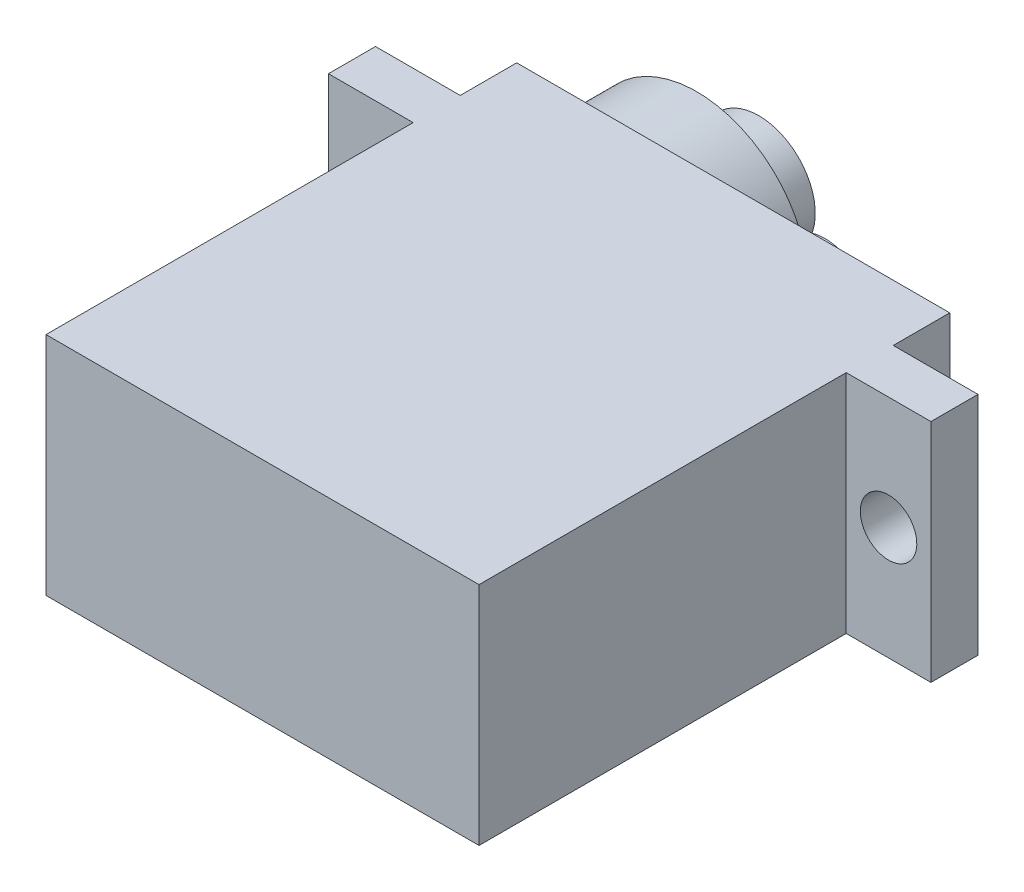
from build123d import *

# Parameters (mm, degrees)
SKETCH1_W            = 23
SKETCH1_H            = 12
BOSS_EXTRUDE1_DEPTH  = 25
SKETCH3_W            = 2.5
SKETCH3_H            = 12
BOSS_EXTRUDE2_DEPTH  = 4.5
SKETCH4_W            = 2.5
SKETCH4_H            = 12
BOSS_EXTRUDE3_DEPTH  = 4.5
SKETCH5_R            = 5.955396546
SKETCH5_R_2          = 2.472840408
SKETCH5_R_3          = 1.966091401
BOSS_EXTRUDE13_DEPTH = 3.5
SKETCH7_R            = 3
BOSS_EXTRUDE14_DEPTH = 3.5
SKETCH8_R            = 1.5
CUT_EXTRUDE1_DEPTH   = 3.5
SKETCH9_W            = 0.717948718
SKETCH9_H            = 0.583333333
CUT_EXTRUDE2_DEPTH   = 3.5
CUT_EXTRUDE3_DEPTH   = 3.5


with BuildPart() as part:
    # Sketch1 → Boss-Extrude1 (new body)
    with BuildSketch(Plane.XY):
        Rectangle(SKETCH1_W, SKETCH1_H)
    extrude(amount=BOSS_EXTRUDE1_DEPTH)

    # Sketch3 → Boss-Extrude2 (add)
    with BuildSketch(Plane(origin=(11.5, 0, 0), x_dir=(0, 0, -1), z_dir=(1, 0, 0))):
        with Locations((-4.25, 0)):
            Rectangle(SKETCH3_W, SKETCH3_H)
    extrude(amount=BOSS_EXTRUDE2_DEPTH)

    # Sketch4 → Boss-Extrude3 (add)
    with BuildSketch(Plane.ZY.offset(11.5)):
        with Locations((4.25, 0)):
            Rectangle(SKETCH4_W, SKETCH4_H)
    extrude(amount=BOSS_EXTRUDE3_DEPTH)

    # Sketch5 → Boss-Extrude13 (add)
    # profile 1 of 7: a face of its own
    with BuildSketch(Plane(origin=(0, 0, 0), x_dir=(-1, 0, 0), z_dir=(0, 0, -1))):
        with Locations((5.443001461, 0)):
            Circle(SKETCH5_R)
    # profile 2 of 7: a face of its own
    with BuildSketch(Plane(origin=(0, 0, 0), x_dir=(-1, 0, 0), z_dir=(0, 0, -1))):
        with Locations((-1.369559257, 0.13462889)):
            Circle(SKETCH5_R_2)
    # profile 3 of 7: a face of its own
    with BuildSketch(Plane(origin=(0, 0, 0), x_dir=(-1, 0, 0), z_dir=(0, 0, -1))):
        with Locations((-1.369559257, 0.13462889)):
            Circle(SKETCH5_R_2)
    # profile 4 of 7: a face of its own
    with BuildSketch(Plane(origin=(0, 0, 0), x_dir=(-1, 0, 0), z_dir=(0, 0, -1))):
        with Locations((5.443001461, 0)):
            Circle(SKETCH5_R)
        with Locations((5.443001461, 0)):
            Circle(SKETCH5_R_3, mode=Mode.SUBTRACT)
    # profile 5 of 7: a face of its own
    with BuildSketch(Plane(origin=(0, 0, 0), x_dir=(-1, 0, 0), z_dir=(0, 0, -1))):
        with Locations((5.443001461, 0)):
            Circle(SKETCH5_R)
    # profile 6 of 7: a face of its own
    with BuildSketch(Plane(origin=(0, 0, 0), x_dir=(-1, 0, 0), z_dir=(0, 0, -1))):
        with Locations((-1.369559257, 0.13462889)):
            Circle(SKETCH5_R_2)
    # profile 7 of 7: a face of its own
    with BuildSketch(Plane(origin=(0, 0, 0), x_dir=(-1, 0, 0), z_dir=(0, 0, -1))):
        with Locations((5.443001461, 0)):
            Circle(SKETCH5_R_3)
    extrude(amount=BOSS_EXTRUDE13_DEPTH)

    # Sketch7 → Boss-Extrude14 (add)
    with BuildSketch(Plane(origin=(0, 0, -3.5), x_dir=(-1, 0, 0), z_dir=(0, 0, -1))):
        with Locations((5.642948454, 0)):
            Circle(SKETCH7_R)
    extrude(amount=BOSS_EXTRUDE14_DEPTH)

    # Sketch8 → Cut-Extrude1 (cut)
    with BuildSketch(Plane(origin=(0, 0, 3), x_dir=(-1, 0, 0), z_dir=(0, 0, -1))):
        with Locations(Location((13.75, 0, 0), (0, 0, 90))):
            Circle(SKETCH8_R)
        with Locations(Location((-13.75, 0, 0), (0, 0, 90))):
            Circle(SKETCH8_R)
    extrude(amount=-CUT_EXTRUDE1_DEPTH, mode=Mode.SUBTRACT)

    # Sketch9 → Cut-Extrude2 (cut)
    # profile 1 of 11: a face of its own
    with BuildSketch(Plane(origin=(0, -6, 0), x_dir=(-1, 0, 0), z_dir=(0, -1, 0))):
        with BuildLine():
            Line((-7.029498247, -7.323823988), (-7.298027894, -7.753611648))
            add(Edge.make_bspline(
                [(-7.298027894, -7.753611648), (-7.309343943, -7.725405147), (-7.330742745, -7.67206627), (-7.366596226, -7.599110292), (-7.402048427, -7.536976801), (-7.437669123, -7.486031044), (-7.473342813, -7.445609931), (-7.510051839, -7.416967875), (-7.547391075, -7.398209945), (-7.57315305, -7.395794026), (-7.58548783, -7.394637289)],
                knots=[0, 0, 0, 0, 1.513815615, 2.862645992, 4.047036384, 5.074482221, 5.956489264, 6.720440714, 7.387349671, 8, 8, 8, 8], degree=3))
            add(Edge.make_bspline(
                [(-7.58548783, -7.394637289), (-7.597078949, -7.395347529), (-7.619923321, -7.396747306), (-7.652145088, -7.411117835), (-7.679882705, -7.434714408), (-7.703986223, -7.465346606), (-7.722832591, -7.501258769), (-7.73746031, -7.540032256), (-7.745812547, -7.581245339), (-7.746899403, -7.609612593), (-7.747446965, -7.623904116)],
                knots=[0, 0, 0, 0, 0.893609532, 1.761171542, 2.674367376, 3.692096672, 4.7611719, 5.803554826, 6.893423158, 8, 8, 8, 8], degree=3))
            add(Edge.make_bspline(
                [(-7.747446965, -7.623904116), (-7.746040801, -7.652926504), (-7.743255996, -7.710403249), (-7.724018118, -7.764627863), (-7.714494241, -7.791472225)],
                knots=[0, 0, 0, 0, 1.009882784, 2, 2, 2, 2], degree=3))
            add(Edge.make_bspline(
                [(-7.714494241, -7.791472225), (-7.70993126, -7.801576539), (-7.699600847, -7.824452317), (-7.679228853, -7.861731129), (-7.65443256, -7.907087444), (-7.623173349, -7.95968464), (-7.586968291, -8.019905491), (-7.544375288, -8.087358866), (-7.497172041, -8.16291293), (-7.463105842, -8.215468417), (-7.445263471, -8.242994661)],
                knots=[0, 0, 0, 0, 0.505642727, 1.144755719, 1.936997808, 2.864123586, 3.935666884, 5.142716957, 6.503481291, 8, 8, 8, 8], degree=3))
            add(Edge.make_bspline(
                [(-7.445263471, -8.242994661), (-7.428433752, -8.268466401), (-7.396524634, -8.316760774), (-7.351220266, -8.385429738), (-7.31258455, -8.447596047), (-7.276744718, -8.500875631), (-7.248657862, -8.548471469), (-7.223632855, -8.587378257), (-7.204722279, -8.619436993), (-7.194447371, -8.638634446), (-7.190055138, -8.646840815)],
                knots=[0, 0, 0, 0, 1.533370667, 2.907268025, 4.131626108, 5.209286774, 6.131298802, 6.906451117, 7.532538771, 8, 8, 8, 8], degree=3))
            add(Edge.make_bspline(
                [(-7.190055138, -8.646840815), (-7.172396418, -8.680546144), (-7.137886386, -8.746415698), (-7.093555709, -8.845726366), (-7.058270283, -8.94329484), (-7.030486093, -9.039544956), (-7.010140983, -9.136863357), (-6.995389221, -9.237289148), (-6.986011594, -9.341940728), (-6.985092666, -9.413380616), (-6.984626452, -9.44962527)],
                knots=[0, 0, 0, 0, 1.089275112, 2.128745462, 3.110876915, 4.057562893, 4.994575095, 5.955064899, 6.96251288, 8, 8, 8, 8], degree=3))
            add(Edge.make_bspline(
                [(-6.984626452, -9.44962527), (-6.985200407, -9.484929111), (-6.986323112, -9.553986437), (-6.994070481, -9.655363931), (-7.007053572, -9.751906874), (-7.026326206, -9.843603726), (-7.049890785, -9.930895441), (-7.079250427, -10.013384977), (-7.113820498, -10.091269489), (-7.153288607, -10.163620799), (-7.197254773, -10.229263325), (-7.244045537, -10.287406565), (-7.294789099, -10.336398045), (-7.349269969, -10.375896445), (-7.406665014, -10.407331907), (-7.467504995, -10.429980486), (-7.531821505, -10.443719884), (-7.575838856, -10.445180426), (-7.598108023, -10.44591934)],
                knots=[0, 0, 0, 0, 1.308901514, 2.560323035, 3.767398777, 4.917911796, 6.032053414, 7.117382618, 8.160844707, 9.188500245, 10.169045156, 11.086613897, 11.950745906, 12.775760447, 13.574509779, 14.369631732, 15.175167501, 16, 16, 16, 16], degree=3))
            add(Edge.make_bspline(
                [(-7.598108023, -10.44591934), (-7.615672816, -10.445404716), (-7.650308144, -10.444389947), (-7.70132971, -10.435565342), (-7.750573765, -10.421722693), (-7.798106651, -10.401495443), (-7.844280041, -10.376687509), (-7.888121693, -10.345117885), (-7.930256479, -10.308423051), (-7.97127568, -10.26630974), (-8.009624417, -10.217128995), (-8.047762594, -10.162752006), (-8.083069282, -10.101044351), (-8.118630879, -10.033881483), (-8.150934908, -9.959491072), (-8.182599858, -9.87900756), (-8.213675398, -9.792456372), (-8.231747156, -9.731804288), (-8.241036709, -9.700626872)],
                knots=[0, 0, 0, 0, 0.796343935, 1.570279377, 2.342178525, 3.112109005, 3.909229001, 4.715324593, 5.557166864, 6.44198091, 7.377558535, 8.383433228, 9.452692693, 10.600350218, 11.829778021, 13.129265353, 14.524336153, 16, 16, 16, 16], degree=3))
            Line((-8.241036709, -9.700626872), (-7.932543119, -9.368996263))
            add(Edge.make_bspline(
                [(-7.932543119, -9.368996263), (-7.920967347, -9.404169009), (-7.899161549, -9.470425484), (-7.863209485, -9.562231234), (-7.824656248, -9.639491931), (-7.785829595, -9.703495837), (-7.745247411, -9.753791903), (-7.702909219, -9.789765423), (-7.658524534, -9.813526945), (-7.627344513, -9.816341078), (-7.612130459, -9.817714212)],
                knots=[0, 0, 0, 0, 1.528548029, 2.879394288, 4.065931244, 5.088610491, 5.965669334, 6.719195773, 7.375041301, 8, 8, 8, 8], degree=3))
            add(Edge.make_bspline(
                [(-7.612130459, -9.817714212), (-7.596711982, -9.816567756), (-7.566047872, -9.814287695), (-7.523157313, -9.793375674), (-7.484154899, -9.761388037), (-7.451208415, -9.717325694), (-7.42351825, -9.665965963), (-7.403045396, -9.609540189), (-7.3909015, -9.548998342), (-7.38929582, -9.507407017), (-7.388472606, -9.486083603)],
                knots=[0, 0, 0, 0, 0.837168625, 1.664952531, 2.553613952, 3.571843386, 4.645016646, 5.730630069, 6.836519038, 8, 8, 8, 8], degree=3))
            add(Edge.make_bspline(
                [(-7.388472606, -9.486083603), (-7.388967485, -9.466184138), (-7.389962443, -9.426176072), (-7.399541042, -9.366265812), (-7.415018915, -9.306399624), (-7.433365102, -9.256392682), (-7.452100276, -9.214447434), (-7.469792333, -9.178751228), (-7.490536749, -9.138705908), (-7.516347866, -9.095577405), (-7.54413424, -9.047470668), (-7.57632928, -8.995751899), (-7.613135655, -8.940656896), (-7.638332314, -8.902300301), (-7.651393279, -8.882417738)],
                knots=[0, 0, 0, 0, 1.070477827, 2.152205962, 3.256735731, 4.394924439, 5.014414402, 5.728928141, 6.539236128, 7.441139399, 8.433599816, 9.529715778, 10.719501013, 12, 12, 12, 12], degree=3))
            add(Edge.make_bspline(
                [(-7.651393279, -8.882417738), (-7.676819062, -8.844678156), (-7.725791945, -8.771987529), (-7.793704535, -8.664800969), (-7.855877844, -8.565077118), (-7.909485343, -8.470828053), (-7.957451469, -8.384147933), (-7.998422152, -8.30407152), (-8.032150964, -8.230632702), (-8.067728126, -8.14223749), (-8.100790695, -8.035415776), (-8.129705466, -7.908163875), (-8.148165008, -7.781028603), (-8.150255293, -7.696179758), (-8.151293119, -7.654052353)],
                knots=[0, 0, 0, 0, 1.215094936, 2.340407834, 3.38829717, 4.352808642, 5.235400207, 6.033645607, 6.754161491, 7.392715116, 8.577000407, 9.735214796, 10.875535395, 12, 12, 12, 12], degree=3))
            add(Edge.make_bspline(
                [(-8.151293119, -7.654052353), (-8.150637107, -7.624128785), (-8.149348939, -7.565369739), (-8.142675372, -7.478642994), (-8.129617343, -7.395419026), (-8.113359544, -7.315083461), (-8.090559094, -7.238345333), (-8.063181821, -7.164892487), (-8.031881703, -7.094198385), (-7.994840244, -7.028300352), (-7.954630779, -6.967760444), (-7.912166987, -6.91376928), (-7.866172711, -6.86899738), (-7.819113161, -6.830839287), (-7.768744329, -6.801693794), (-7.715955418, -6.781376969), (-7.660850155, -6.768897039), (-7.623413368, -6.767261849), (-7.604418119, -6.766432161)],
                knots=[0, 0, 0, 0, 1.254354283, 2.463097322, 3.641944594, 4.783035432, 5.895733406, 6.992845328, 8.066935729, 9.132461787, 10.156622158, 11.111156399, 12.004638905, 12.841397578, 13.64445675, 14.432075676, 15.204442572, 16, 16, 16, 16], degree=3))
            add(Edge.make_bspline(
                [(-7.604418119, -6.766432161), (-7.579701186, -6.767957205), (-7.529956598, -6.771026464), (-7.457024144, -6.79520617), (-7.385927751, -6.832795059), (-7.330125303, -6.877173564), (-7.285117732, -6.919763239), (-7.250970324, -6.959816511), (-7.21527572, -7.004925927), (-7.179413926, -7.056929623), (-7.142445177, -7.114544696), (-7.10547456, -7.179008561), (-7.066580015, -7.248726594), (-7.042133538, -7.298235203), (-7.029498247, -7.323823988)],
                knots=[0, 0, 0, 0, 1.053770877, 2.120788981, 3.250439966, 4.474277998, 5.151977451, 5.894695425, 6.719345712, 7.608185047, 8.591126753, 9.642247106, 10.781383004, 12, 12, 12, 12], degree=3))
        make_face()
    # profile 2 of 11: a face of its own
    with BuildSketch(Plane(origin=(0, -6, 0), x_dir=(-1, 0, 0), z_dir=(0, -1, 0))):
        with BuildLine():
            Line((-5.146285106, -9.234380879), (-6.311549529, -9.234380879))
            add(Edge.make_bspline(
                [(-6.311549529, -9.234380879), (-6.306325159, -9.280079102), (-6.296359408, -9.367250772), (-6.268727943, -9.490307519), (-6.229548505, -9.598535661), (-6.187741691, -9.678199446), (-6.148740521, -9.732350742), (-6.118623352, -9.767579666), (-6.085313316, -9.796155281), (-6.050845986, -9.820248631), (-6.014804807, -9.839678394), (-5.976489363, -9.853067752), (-5.936064353, -9.860866812), (-5.908438342, -9.862006253), (-5.894382061, -9.862586007)],
                knots=[0, 0, 0, 0, 2.00293182, 3.820693659, 5.479502867, 7.005516046, 7.72038845, 8.384130814, 9.019139803, 9.626361114, 10.213887248, 10.796719121, 11.387763407, 12, 12, 12, 12], degree=3))
            add(Edge.make_bspline(
                [(-5.894382061, -9.862586007), (-5.877468488, -9.861809188), (-5.843861484, -9.860265661), (-5.794919901, -9.846819394), (-5.747468972, -9.826147635), (-5.70222997, -9.796524467), (-5.658944615, -9.758482923), (-5.617538862, -9.712633541), (-5.57818911, -9.658118901), (-5.554691698, -9.617878529), (-5.54241892, -9.596860847)],
                knots=[0, 0, 0, 0, 0.874505432, 1.73762853, 2.610205243, 3.546913647, 4.52501498, 5.587546354, 6.739967356, 8, 8, 8, 8], degree=3))
            Line((-5.54241892, -9.596860847), (-5.234626452, -9.847161328))
            add(Edge.make_bspline(
                [(-5.234626452, -9.847161328), (-5.254531798, -9.891544655), (-5.292638075, -9.976510946), (-5.361340284, -10.09123749), (-5.435863388, -10.187879858), (-5.516304942, -10.267017519), (-5.605185723, -10.326970484), (-5.701153325, -10.37072263), (-5.805648333, -10.396409631), (-5.877882453, -10.399481302), (-5.914714593, -10.401047545)],
                knots=[0, 0, 0, 0, 1.245748866, 2.384829348, 3.417529423, 4.366306972, 5.263314617, 6.150552003, 7.056967443, 8, 8, 8, 8], degree=3))
            add(Edge.make_bspline(
                [(-5.914714593, -10.401047545), (-5.943789025, -10.400079317), (-6.00085766, -10.398178834), (-6.084282705, -10.379817486), (-6.16328874, -10.350159208), (-6.238485608, -10.309030801), (-6.309156313, -10.255749198), (-6.374998152, -10.190284993), (-6.437950244, -10.11440961), (-6.494215025, -10.02657624), (-6.547012456, -9.931438062), (-6.591428203, -9.828256281), (-6.630247513, -9.719986705), (-6.660779861, -9.605414281), (-6.685525816, -9.485369208), (-6.702702657, -9.359114038), (-6.713489957, -9.2270912), (-6.714752274, -9.137180149), (-6.715395683, -9.091352033)],
                knots=[0, 0, 0, 0, 0.821815462, 1.613097244, 2.404213167, 3.20336093, 4.030085173, 4.899993948, 5.825570722, 6.814305267, 7.847285877, 8.901600145, 9.989363176, 11.099614129, 12.254019607, 13.455929952, 14.703274657, 16, 16, 16, 16], degree=3))
            add(Edge.make_bspline(
                [(-6.715395683, -9.091352033), (-6.714769522, -9.04435348), (-6.713540495, -8.95210487), (-6.702536354, -8.817110275), (-6.686390583, -8.687948635), (-6.661331541, -8.565185413), (-6.631125171, -8.448064461), (-6.592895396, -8.337295051), (-6.548210201, -8.232619605), (-6.496698359, -8.135148557), (-6.440300083, -8.0464389), (-6.380502959, -7.967795745), (-6.315564782, -7.902248154), (-6.247653554, -7.848177884), (-6.176588259, -7.805112374), (-6.101058136, -7.77585536), (-6.022509258, -7.756335671), (-5.968585177, -7.754525606), (-5.941357221, -7.753611648)],
                knots=[0, 0, 0, 0, 1.327688858, 2.605983448, 3.824748862, 5.003224592, 6.143621814, 7.239960965, 8.310787262, 9.356458241, 10.351137754, 11.278365338, 12.142196764, 12.950725969, 13.72647493, 14.479375456, 15.232189105, 16, 16, 16, 16], degree=3))
            add(Edge.make_bspline(
                [(-5.941357221, -7.753611648), (-5.912517194, -7.754592788), (-5.855683847, -7.756526262), (-5.772498053, -7.77486093), (-5.693647462, -7.804355117), (-5.618628453, -7.845763054), (-5.548862021, -7.899505749), (-5.482620753, -7.96437921), (-5.421343925, -8.041231889), (-5.364068682, -8.128773716), (-5.312644593, -8.225783835), (-5.267853702, -8.330982123), (-5.228897216, -8.443258005), (-5.198852348, -8.563555764), (-5.17370723, -8.690751897), (-5.157747676, -8.825776848), (-5.146685417, -8.968237405), (-5.145493706, -9.065854814), (-5.144882862, -9.115891295)],
                knots=[0, 0, 0, 0, 0.792468507, 1.561671118, 2.330712499, 3.101927644, 3.909457693, 4.746001565, 5.646670277, 6.607816118, 7.620234016, 8.662823515, 9.750583281, 10.885796409, 12.071047244, 13.315069537, 14.623765234, 16, 16, 16, 16], degree=3))
            Line((-5.144882862, -9.115891295), (-5.146285106, -9.234380879))
        make_face()
        with BuildLine():
            add(Edge.make_bspline(
                [(-5.548729016, -8.740791135), (-5.555269335, -8.709063276), (-5.56796213, -8.647489026), (-5.597928429, -8.561060973), (-5.63708051, -8.484067767), (-5.683276893, -8.417037619), (-5.73613521, -8.361806873), (-5.794461369, -8.321156473), (-5.858157507, -8.296426663), (-5.90235469, -8.293527713), (-5.924530298, -8.292073186)],
                knots=[0, 0, 0, 0, 1.225910497, 2.379124237, 3.451785653, 4.487896126, 5.451744876, 6.330575134, 7.162378472, 8, 8, 8, 8], degree=3))
            add(Edge.make_bspline(
                [(-5.924530298, -8.292073186), (-5.948659415, -8.293511394), (-5.99682712, -8.296382412), (-6.065158946, -8.325747693), (-6.129540604, -8.369808124), (-6.164277485, -8.41076255), (-6.182543119, -8.432297545)],
                knots=[0, 0, 0, 0, 0.947074985, 1.890596711, 2.890816105, 4, 4, 4, 4], degree=3))
            add(Edge.make_bspline(
                [(-6.182543119, -8.432297545), (-6.194563645, -8.44926456), (-6.221246631, -8.486927688), (-6.25161414, -8.557557476), (-6.284585999, -8.642719583), (-6.302110697, -8.706460286), (-6.311549529, -8.740791135)],
                knots=[0, 0, 0, 0, 0.740226917, 1.643144803, 2.730593836, 4, 4, 4, 4], degree=3))
            Line((-6.311549529, -8.740791135), (-5.548729016, -8.740791135))
        make_face(mode=Mode.SUBTRACT)
    # profile 3 of 11: a face of its own
    with BuildSketch(Plane(origin=(0, -6, 0), x_dir=(-1, 0, 0), z_dir=(0, -1, 0))):
        with BuildLine():
            Line((-4.875652093, -7.798483443), (-4.516677734, -7.798483443))
            Line((-4.516677734, -7.798483443), (-4.516677734, -8.113287129))
            add(Edge.make_bspline(
                [(-4.516677734, -8.113287129), (-4.509152221, -8.08558455), (-4.494819951, -8.032825245), (-4.468029556, -7.960001417), (-4.436861909, -7.897954746), (-4.402979733, -7.846403038), (-4.365704323, -7.805550557), (-4.326032337, -7.776201501), (-4.284386769, -7.756803574), (-4.255347877, -7.754660448), (-4.241136869, -7.753611648)],
                knots=[0, 0, 0, 0, 1.423334253, 2.710726865, 3.840736876, 4.859788011, 5.761921624, 6.566363284, 7.298409075, 8, 8, 8, 8], degree=3))
            add(Edge.make_bspline(
                [(-4.241136869, -7.753611648), (-4.230784773, -7.754621592), (-4.209079113, -7.756739183), (-4.176137948, -7.768289243), (-4.143971776, -7.789644485), (-4.12360535, -7.80734768), (-4.11283158, -7.81671261)],
                knots=[0, 0, 0, 0, 0.851681845, 1.785755831, 2.828672471, 4, 4, 4, 4], degree=3))
            Line((-4.11283158, -7.81671261), (-4.21028751, -8.348864052))
            add(Edge.make_bspline(
                [(-4.21028751, -8.348864052), (-4.219040043, -8.340528617), (-4.235043981, -8.325287338), (-4.258474749, -8.306750341), (-4.280063556, -8.294687373), (-4.294316354, -8.29288467), (-4.300732221, -8.292073186)],
                knots=[0, 0, 0, 0, 1.329240489, 2.430505927, 3.293495475, 4, 4, 4, 4], degree=3))
            add(Edge.make_bspline(
                [(-4.300732221, -8.292073186), (-4.306652183, -8.292675533), (-4.319056295, -8.29393763), (-4.337127405, -8.302890747), (-4.353021257, -8.318460753), (-4.368799902, -8.338742781), (-4.384066934, -8.364567001), (-4.397749667, -8.396858786), (-4.411789769, -8.434151991), (-4.424465191, -8.478239234), (-4.436868726, -8.530258462), (-4.445989533, -8.592927592), (-4.454372485, -8.666579242), (-4.461167527, -8.751237733), (-4.466665749, -8.846847454), (-4.470976672, -8.953429094), (-4.472786842, -9.071013014), (-4.473063797, -9.153050472), (-4.473208183, -9.19581918)],
                knots=[0, 0, 0, 0, 0.296809874, 0.621906527, 0.987026169, 1.404480485, 1.909126721, 2.486431564, 3.16151366, 3.907118283, 4.785817413, 5.842019697, 7.080977384, 8.504330977, 10.101453798, 11.884780886, 13.854606785, 16, 16, 16, 16], degree=3))
            Line((-4.473208183, -9.19581918), (-4.471805939, -9.32061886))
            Line((-4.471805939, -9.32061886), (-4.471805939, -10.356175751))
            Line((-4.471805939, -10.356175751), (-4.875652093, -10.356175751))
            Line((-4.875652093, -10.356175751), (-4.875652093, -7.798483443))
        make_face()
    # profile 4 of 11: a face of its own
    with BuildSketch(Plane(origin=(0, -6, 0), x_dir=(-1, 0, 0), z_dir=(0, -1, 0))):
        Polygon((-4.135267478, -7.798483443), (-3.720904497, -7.798483443), (-3.372446965, -9.307998667), (-3.025391677, -7.798483443), (-2.609626452, -7.798483443), (-3.197166516, -10.356175751), (-3.547026292, -10.356175751), align=None)
    # profile 5 of 11: a face of its own
    with BuildSketch(Plane(origin=(0, -6, 0), x_dir=(-1, 0, 0), z_dir=(0, -1, 0))):
        with BuildLine():
            add(Edge.make_bspline(
                [(-1.586689753, -7.753611648), (-1.56913012, -7.754153523), (-1.534043569, -7.755236265), (-1.481830128, -7.763945582), (-1.430576268, -7.778286737), (-1.379666167, -7.796814775), (-1.330312244, -7.822883806), (-1.281512542, -7.853515202), (-1.23321266, -7.889619504), (-1.170529875, -7.946474736), (-1.095620789, -8.028035742), (-1.017644612, -8.142278298), (-0.950486971, -8.27251217), (-0.893821535, -8.41660787), (-0.848773065, -8.57159092), (-0.81579486, -8.734057126), (-0.795688692, -8.902709892), (-0.793452019, -9.017211508), (-0.79231876, -9.075226231)],
                knots=[0, 0, 0, 0, 0.498953948, 0.996978292, 1.499809037, 2.010650751, 2.533574202, 3.082841117, 3.647519731, 4.245008617, 5.486430885, 6.785561185, 8.164293431, 9.643418898, 11.180142746, 12.746181886, 14.351382572, 16, 16, 16, 16], degree=3))
            add(Edge.make_bspline(
                [(-0.79231876, -9.075226231), (-0.793450515, -9.133708309), (-0.795684403, -9.24914181), (-0.815816407, -9.419185645), (-0.848801485, -9.583574845), (-0.894390361, -9.740357172), (-0.951240496, -9.885912806), (-1.017106852, -10.017147004), (-1.095232524, -10.130097055), (-1.167348242, -10.212334939), (-1.230190889, -10.267035559), (-1.277062999, -10.303323175), (-1.325553952, -10.333410002), (-1.374960304, -10.358334404), (-1.425725807, -10.377460354), (-1.477982676, -10.390549883), (-1.53123144, -10.39947694), (-1.567256169, -10.400523643), (-1.58528751, -10.401047545)],
                knots=[0, 0, 0, 0, 1.656264952, 3.269180419, 4.842891851, 6.401686251, 7.888119366, 9.265016889, 10.550538073, 11.769515322, 12.351239632, 12.908722698, 13.447003998, 13.965161284, 14.474272309, 14.980100942, 15.489513229, 16, 16, 16, 16], degree=3))
            add(Edge.make_bspline(
                [(-1.58528751, -10.401047545), (-1.611788625, -10.399747841), (-1.664205912, -10.397177119), (-1.741307704, -10.379149547), (-1.814910405, -10.348398616), (-1.885579108, -10.305668126), (-1.953505769, -10.251001222), (-2.01759198, -10.183666702), (-2.079893203, -10.105425058), (-2.136848867, -10.015380911), (-2.189909642, -9.917368345), (-2.236050108, -9.812704111), (-2.275283117, -9.703029219), (-2.307912784, -9.588348928), (-2.33177345, -9.468189943), (-2.350405044, -9.343305763), (-2.360852019, -9.21305946), (-2.36216312, -9.124556129), (-2.36283158, -9.079432962)],
                knots=[0, 0, 0, 0, 0.757268579, 1.497822431, 2.249620092, 3.028674568, 3.8507904, 4.734238136, 5.680514419, 6.70524415, 7.775287347, 8.863936352, 9.971180801, 11.102605878, 12.268626126, 13.470344302, 14.710262363, 16, 16, 16, 16], degree=3))
            add(Edge.make_bspline(
                [(-2.36283158, -9.079432962), (-2.36198828, -9.031266286), (-2.360335868, -8.936885713), (-2.348434169, -8.798435518), (-2.328005652, -8.666151393), (-2.300110978, -8.539852281), (-2.264552822, -8.41944134), (-2.220235742, -8.305481146), (-2.167729334, -8.197527373), (-2.126182485, -8.130029233), (-2.105519882, -8.096460206)],
                knots=[0, 0, 0, 0, 1.121811857, 2.198143086, 3.233602208, 4.237311924, 5.208646479, 6.154808683, 7.082326169, 8, 8, 8, 8], degree=3))
            add(Edge.make_bspline(
                [(-2.105519882, -8.096460206), (-2.086863778, -8.069203662), (-2.050972459, -8.016766493), (-1.990847872, -7.946964112), (-1.929072907, -7.887507303), (-1.865175479, -7.838443165), (-1.798554743, -7.800781375), (-1.729910087, -7.77384984), (-1.659014543, -7.756946921), (-1.610852535, -7.75472592), (-1.586689753, -7.753611648)],
                knots=[0, 0, 0, 0, 1.220761442, 2.348547062, 3.400027255, 4.38708449, 5.319780212, 6.220200227, 7.107078062, 8, 8, 8, 8], degree=3))
        make_face()
        with BuildLine():
            add(Edge.make_bspline(
                [(-1.578276292, -8.336944981), (-1.591631348, -8.337754655), (-1.618177287, -8.339364048), (-1.657489175, -8.348179342), (-1.693948855, -8.365808097), (-1.729260203, -8.38869467), (-1.762399985, -8.418293711), (-1.794811462, -8.453793459), (-1.823404799, -8.496984174), (-1.861875626, -8.56272102), (-1.901780468, -8.657078443), (-1.934908246, -8.783377264), (-1.955297424, -8.923828567), (-1.957719445, -9.022335029), (-1.958985427, -9.073823988)],
                knots=[0, 0, 0, 0, 0.531406066, 1.056279542, 1.588172318, 2.131694732, 2.724043708, 3.348779607, 4.036600694, 4.777313526, 6.374828638, 8.087010827, 9.95469519, 12, 12, 12, 12], degree=3))
            add(Edge.make_bspline(
                [(-1.958985427, -9.073823988), (-1.957643168, -9.126702501), (-1.955085026, -9.227480905), (-1.935867363, -9.37108169), (-1.902678958, -9.498956488), (-1.86307906, -9.59397562), (-1.825357358, -9.659724534), (-1.795401148, -9.70141012), (-1.765074113, -9.738084643), (-1.731011455, -9.766468995), (-1.696138263, -9.789974694), (-1.658857655, -9.806133124), (-1.61961714, -9.815375748), (-1.59304618, -9.816931517), (-1.579678535, -9.817714212)],
                knots=[0, 0, 0, 0, 2.083844641, 3.971490933, 5.696411459, 7.277284296, 8.011958627, 8.679080092, 9.299544049, 9.881039513, 10.420130978, 10.952331548, 11.472926106, 12, 12, 12, 12], degree=3))
            add(Edge.make_bspline(
                [(-1.579678535, -9.817714212), (-1.566062983, -9.817011198), (-1.539173644, -9.815622815), (-1.500044343, -9.805407021), (-1.462992695, -9.788897133), (-1.42744113, -9.766093212), (-1.393852803, -9.736387453), (-1.362299726, -9.700030335), (-1.331864478, -9.65776583), (-1.294398195, -9.59093628), (-1.253854339, -9.495751283), (-1.220179805, -9.368052738), (-1.199855651, -9.22568146), (-1.197433311, -9.126012918), (-1.196164914, -9.073823988)],
                knots=[0, 0, 0, 0, 0.535648601, 1.05785183, 1.581026902, 2.127240038, 2.714100245, 3.339916738, 4.019124428, 4.76094841, 6.352116621, 8.077481587, 9.946071712, 12, 12, 12, 12], degree=3))
            add(Edge.make_bspline(
                [(-1.196164914, -9.073823988), (-1.197505926, -9.02164797), (-1.200060151, -8.922268393), (-1.219293688, -8.780498167), (-1.252714787, -8.654169642), (-1.291706605, -8.559716129), (-1.330325832, -8.49484403), (-1.359142535, -8.452301573), (-1.391112544, -8.417135783), (-1.424262979, -8.387416684), (-1.460252628, -8.365143015), (-1.497843512, -8.348317324), (-1.537664604, -8.339322334), (-1.564682554, -8.33774074), (-1.578276292, -8.336944981)],
                knots=[0, 0, 0, 0, 2.065846563, 3.934814648, 5.649911842, 7.229656319, 7.959772155, 8.637571837, 9.260110413, 9.837317662, 10.3945175, 10.929205137, 11.461243205, 12, 12, 12, 12], degree=3))
        make_face(mode=Mode.SUBTRACT)
    # profile 6 of 11: a face of its own
    with BuildSketch(Plane(origin=(0, -6, 0), x_dir=(-1, 0, 0), z_dir=(0, -1, 0))):
        with Locations((-0.029498247, -9.077329597)):
            Rectangle(SKETCH9_W, SKETCH9_H)
    # profile 7 of 11: a face of its own
    with BuildSketch(Plane(origin=(0, -6, 0), x_dir=(-1, 0, 0), z_dir=(0, -1, 0))):
        Polygon((0.909303836, -6.856175751), (1.390974509, -6.856175751), (1.787809445, -9.29748184), (2.186046625, -6.856175751), (2.664211689, -6.856175751), (2.976912009, -10.356175751), (2.568158003, -10.356175751), (2.371142779, -8.145538731), (2.010766176, -10.356175751), (1.563450471, -10.356175751), (1.204476112, -8.145538731), (1.008162009, -10.356175751), (0.598706881, -10.356175751), align=None)
    # profile 8 of 11: a face of its own
    with BuildSketch(Plane(origin=(0, -6, 0), x_dir=(-1, 0, 0), z_dir=(0, -1, 0))):
        with BuildLine():
            add(Edge.make_bspline(
                [(4.022284606, -7.753611648), (4.039844239, -7.754153523), (4.07493079, -7.755236265), (4.127144231, -7.763945582), (4.178398091, -7.778286737), (4.229308192, -7.796814775), (4.278662115, -7.822883806), (4.327461817, -7.853515202), (4.375761699, -7.889619504), (4.438444484, -7.946474736), (4.51335357, -8.028035742), (4.591329747, -8.142278298), (4.658487388, -8.27251217), (4.715152824, -8.41660787), (4.760201294, -8.57159092), (4.793179499, -8.734057126), (4.813285667, -8.902709892), (4.81552234, -9.017211508), (4.816655599, -9.075226231)],
                knots=[0, 0, 0, 0, 0.498953948, 0.996978292, 1.499809037, 2.010650751, 2.533574202, 3.082841117, 3.647519731, 4.245008617, 5.486430885, 6.785561185, 8.164293431, 9.643418898, 11.180142746, 12.746181886, 14.351382572, 16, 16, 16, 16], degree=3))
            add(Edge.make_bspline(
                [(4.816655599, -9.075226231), (4.815523844, -9.133708309), (4.813289956, -9.24914181), (4.793157952, -9.419185645), (4.760172874, -9.583574845), (4.714583998, -9.740357172), (4.657733863, -9.885912806), (4.591867507, -10.017147004), (4.513741835, -10.130097055), (4.441626117, -10.212334939), (4.37878347, -10.267035559), (4.33191136, -10.303323175), (4.283420407, -10.333410002), (4.234014055, -10.358334404), (4.183248552, -10.377460354), (4.130991683, -10.390549883), (4.077742919, -10.39947694), (4.04171819, -10.400523643), (4.023686849, -10.401047545)],
                knots=[0, 0, 0, 0, 1.656264952, 3.269180419, 4.842891851, 6.401686251, 7.888119366, 9.265016889, 10.550538073, 11.769515322, 12.351239632, 12.908722698, 13.447003998, 13.965161284, 14.474272309, 14.980100942, 15.489513229, 16, 16, 16, 16], degree=3))
            add(Edge.make_bspline(
                [(4.023686849, -10.401047545), (3.997185734, -10.399747841), (3.944768447, -10.397177119), (3.867666655, -10.379149547), (3.794063954, -10.348398616), (3.723395251, -10.305668126), (3.65546859, -10.251001222), (3.591382379, -10.183666702), (3.529081156, -10.105425058), (3.472125492, -10.015380911), (3.419064717, -9.917368345), (3.372924251, -9.812704111), (3.333691242, -9.703029219), (3.301061575, -9.588348928), (3.277200909, -9.468189943), (3.258569315, -9.343305763), (3.24812234, -9.21305946), (3.246811239, -9.124556129), (3.246142779, -9.079432962)],
                knots=[0, 0, 0, 0, 0.757268579, 1.497822431, 2.249620092, 3.028674568, 3.8507904, 4.734238136, 5.680514419, 6.70524415, 7.775287347, 8.863936352, 9.971180801, 11.102605878, 12.268626126, 13.470344302, 14.710262363, 16, 16, 16, 16], degree=3))
            add(Edge.make_bspline(
                [(3.246142779, -9.079432962), (3.246986079, -9.031266286), (3.248638491, -8.936885713), (3.26054019, -8.798435518), (3.280968707, -8.666151393), (3.308863381, -8.539852281), (3.344421537, -8.41944134), (3.388738617, -8.305481146), (3.441245025, -8.197527373), (3.482791874, -8.130029233), (3.503454477, -8.096460206)],
                knots=[0, 0, 0, 0, 1.121811857, 2.198143086, 3.233602208, 4.237311924, 5.208646479, 6.154808683, 7.082326169, 8, 8, 8, 8], degree=3))
            add(Edge.make_bspline(
                [(3.503454477, -8.096460206), (3.522110581, -8.069203662), (3.5580019, -8.016766493), (3.618126487, -7.946964112), (3.679901452, -7.887507303), (3.74379888, -7.838443165), (3.810419616, -7.800781375), (3.879064272, -7.77384984), (3.949959816, -7.756946921), (3.998121824, -7.75472592), (4.022284606, -7.753611648)],
                knots=[0, 0, 0, 0, 1.220761442, 2.348547062, 3.400027255, 4.38708449, 5.319780212, 6.220200227, 7.107078062, 8, 8, 8, 8], degree=3))
        make_face()
        with BuildLine():
            add(Edge.make_bspline(
                [(4.030698067, -8.336944981), (4.017343011, -8.337754655), (3.990797072, -8.339364048), (3.951485184, -8.348179342), (3.915025504, -8.365808097), (3.879714156, -8.38869467), (3.846574373, -8.418293711), (3.814162897, -8.453793459), (3.78556956, -8.496984174), (3.747098733, -8.56272102), (3.707193891, -8.657078443), (3.674066113, -8.783377264), (3.653676935, -8.923828567), (3.651254914, -9.022335029), (3.649988932, -9.073823988)],
                knots=[0, 0, 0, 0, 0.531406066, 1.056279542, 1.588172318, 2.131694732, 2.724043708, 3.348779607, 4.036600694, 4.777313526, 6.374828638, 8.087010827, 9.95469519, 12, 12, 12, 12], degree=3))
            add(Edge.make_bspline(
                [(3.649988932, -9.073823988), (3.651331191, -9.126702501), (3.653889333, -9.227480905), (3.673106996, -9.37108169), (3.706295401, -9.498956488), (3.745895299, -9.59397562), (3.783617, -9.659724534), (3.813573211, -9.70141012), (3.843900246, -9.738084643), (3.877962904, -9.766468995), (3.912836095, -9.789974694), (3.950116704, -9.806133124), (3.989357219, -9.815375748), (4.015928179, -9.816931517), (4.029295823, -9.817714212)],
                knots=[0, 0, 0, 0, 2.083844641, 3.971490933, 5.696411459, 7.277284296, 8.011958627, 8.679080092, 9.299544049, 9.881039513, 10.420130978, 10.952331548, 11.472926106, 12, 12, 12, 12], degree=3))
            add(Edge.make_bspline(
                [(4.029295823, -9.817714212), (4.042911376, -9.817011198), (4.069800715, -9.815622815), (4.108930016, -9.805407021), (4.145981664, -9.788897133), (4.181533229, -9.766093212), (4.215121556, -9.736387453), (4.246674633, -9.700030335), (4.277109881, -9.65776583), (4.314576164, -9.59093628), (4.35512002, -9.495751283), (4.388794554, -9.368052738), (4.409118708, -9.22568146), (4.411541048, -9.126012918), (4.412809445, -9.073823988)],
                knots=[0, 0, 0, 0, 0.535648601, 1.05785183, 1.581026902, 2.127240038, 2.714100245, 3.339916738, 4.019124428, 4.76094841, 6.352116621, 8.077481587, 9.946071712, 12, 12, 12, 12], degree=3))
            add(Edge.make_bspline(
                [(4.412809445, -9.073823988), (4.411468433, -9.02164797), (4.408914208, -8.922268393), (4.389680671, -8.780498167), (4.356259572, -8.654169642), (4.317267754, -8.559716129), (4.278648527, -8.49484403), (4.249831824, -8.452301573), (4.217861815, -8.417135783), (4.18471138, -8.387416684), (4.148721731, -8.365143015), (4.111130847, -8.348317324), (4.071309755, -8.339322334), (4.044291805, -8.33774074), (4.030698067, -8.336944981)],
                knots=[0, 0, 0, 0, 2.065846563, 3.934814648, 5.649911842, 7.229656319, 7.959772155, 8.637571837, 9.260110413, 9.837317662, 10.3945175, 10.929205137, 11.461243205, 12, 12, 12, 12], degree=3))
        make_face(mode=Mode.SUBTRACT)
    # profile 9 of 11: a face of its own
    with BuildSketch(Plane(origin=(0, -6, 0), x_dir=(-1, 0, 0), z_dir=(0, -1, 0))):
        Polygon((5.130758163, -6.766432161), (5.534604317, -6.766432161), (5.534604317, -7.798483443), (5.758963291, -7.798483443), (5.758963291, -8.336944981), (5.534604317, -8.336944981), (5.534604317, -10.356175751), (5.130758163, -10.356175751), (5.130758163, -8.336944981), (4.951270984, -8.336944981), (4.951270984, -7.798483443), (5.130758163, -7.798483443), align=None)
    # profile 10 of 11: a face of its own
    with BuildSketch(Plane(origin=(0, -6, 0), x_dir=(-1, 0, 0), z_dir=(0, -1, 0))):
        with BuildLine():
            add(Edge.make_bspline(
                [(6.714592298, -7.753611648), (6.732151931, -7.754153523), (6.767238482, -7.755236265), (6.819451923, -7.763945582), (6.870705783, -7.778286737), (6.921615884, -7.796814775), (6.970969808, -7.822883806), (7.019769509, -7.853515202), (7.068069392, -7.889619504), (7.130752177, -7.946474736), (7.205661262, -8.028035742), (7.283637439, -8.142278298), (7.350795081, -8.27251217), (7.407460516, -8.41660787), (7.452508986, -8.57159092), (7.485487191, -8.734057126), (7.505593359, -8.902709892), (7.507830032, -9.017211508), (7.508963291, -9.075226231)],
                knots=[0, 0, 0, 0, 0.498953948, 0.996978292, 1.499809037, 2.010650751, 2.533574202, 3.082841117, 3.647519731, 4.245008617, 5.486430885, 6.785561185, 8.164293431, 9.643418898, 11.180142746, 12.746181886, 14.351382572, 16, 16, 16, 16], degree=3))
            add(Edge.make_bspline(
                [(7.508963291, -9.075226231), (7.507831537, -9.133708309), (7.505597649, -9.24914181), (7.485465644, -9.419185645), (7.452480566, -9.583574845), (7.40689169, -9.740357172), (7.350041555, -9.885912806), (7.2841752, -10.017147004), (7.206049527, -10.130097055), (7.133933809, -10.212334939), (7.071091162, -10.267035559), (7.024219052, -10.303323175), (6.975728099, -10.333410002), (6.926321747, -10.358334404), (6.875556245, -10.377460354), (6.823299376, -10.390549883), (6.770050611, -10.39947694), (6.734025882, -10.400523643), (6.715994541, -10.401047545)],
                knots=[0, 0, 0, 0, 1.656264952, 3.269180419, 4.842891851, 6.401686251, 7.888119366, 9.265016889, 10.550538073, 11.769515322, 12.351239632, 12.908722698, 13.447003998, 13.965161284, 14.474272309, 14.980100942, 15.489513229, 16, 16, 16, 16], degree=3))
            add(Edge.make_bspline(
                [(6.715994541, -10.401047545), (6.689493426, -10.399747841), (6.637076139, -10.397177119), (6.559974347, -10.379149547), (6.486371647, -10.348398616), (6.415702943, -10.305668126), (6.347776283, -10.251001222), (6.283690072, -10.183666702), (6.221388848, -10.105425058), (6.164433185, -10.015380911), (6.111372409, -9.917368345), (6.065231943, -9.812704111), (6.025998935, -9.703029219), (5.993369267, -9.588348928), (5.969508601, -9.468189943), (5.950877008, -9.343305763), (5.940430032, -9.21305946), (5.939118932, -9.124556129), (5.938450471, -9.079432962)],
                knots=[0, 0, 0, 0, 0.757268579, 1.497822431, 2.249620092, 3.028674568, 3.8507904, 4.734238136, 5.680514419, 6.70524415, 7.775287347, 8.863936352, 9.971180801, 11.102605878, 12.268626126, 13.470344302, 14.710262363, 16, 16, 16, 16], degree=3))
            add(Edge.make_bspline(
                [(5.938450471, -9.079432962), (5.939293772, -9.031266286), (5.940946183, -8.936885713), (5.952847883, -8.798435518), (5.9732764, -8.666151393), (6.001171073, -8.539852281), (6.03672923, -8.41944134), (6.081046309, -8.305481146), (6.133552717, -8.197527373), (6.175099566, -8.130029233), (6.19576217, -8.096460206)],
                knots=[0, 0, 0, 0, 1.121811857, 2.198143086, 3.233602208, 4.237311924, 5.208646479, 6.154808683, 7.082326169, 8, 8, 8, 8], degree=3))
            add(Edge.make_bspline(
                [(6.19576217, -8.096460206), (6.214418274, -8.069203662), (6.250309592, -8.016766493), (6.310434179, -7.946964112), (6.372209145, -7.887507303), (6.436106573, -7.838443165), (6.502727308, -7.800781375), (6.571371964, -7.77384984), (6.642267508, -7.756946921), (6.690429516, -7.75472592), (6.714592298, -7.753611648)],
                knots=[0, 0, 0, 0, 1.220761442, 2.348547062, 3.400027255, 4.38708449, 5.319780212, 6.220200227, 7.107078062, 8, 8, 8, 8], degree=3))
        make_face()
        with BuildLine():
            add(Edge.make_bspline(
                [(6.723005759, -8.336944981), (6.709650703, -8.337754655), (6.683104764, -8.339364048), (6.643792877, -8.348179342), (6.607333196, -8.365808097), (6.572021848, -8.38869467), (6.538882066, -8.418293711), (6.506470589, -8.453793459), (6.477877253, -8.496984174), (6.439406425, -8.56272102), (6.399501583, -8.657078443), (6.366373805, -8.783377264), (6.345984628, -8.923828567), (6.343562606, -9.022335029), (6.342296625, -9.073823988)],
                knots=[0, 0, 0, 0, 0.531406066, 1.056279542, 1.588172318, 2.131694732, 2.724043708, 3.348779607, 4.036600694, 4.777313526, 6.374828638, 8.087010827, 9.95469519, 12, 12, 12, 12], degree=3))
            add(Edge.make_bspline(
                [(6.342296625, -9.073823988), (6.343638884, -9.126702501), (6.346197025, -9.227480905), (6.365414689, -9.37108169), (6.398603094, -9.498956488), (6.438202991, -9.59397562), (6.475924693, -9.659724534), (6.505880903, -9.70141012), (6.536207938, -9.738084643), (6.570270596, -9.766468995), (6.605143788, -9.789974694), (6.642424396, -9.806133124), (6.681664911, -9.815375748), (6.708235871, -9.816931517), (6.721603516, -9.817714212)],
                knots=[0, 0, 0, 0, 2.083844641, 3.971490933, 5.696411459, 7.277284296, 8.011958627, 8.679080092, 9.299544049, 9.881039513, 10.420130978, 10.952331548, 11.472926106, 12, 12, 12, 12], degree=3))
            add(Edge.make_bspline(
                [(6.721603516, -9.817714212), (6.735219068, -9.817011198), (6.762108407, -9.815622815), (6.801237708, -9.805407021), (6.838289356, -9.788897133), (6.873840922, -9.766093212), (6.907429248, -9.736387453), (6.938982326, -9.700030335), (6.969417573, -9.65776583), (7.006883856, -9.59093628), (7.047427712, -9.495751283), (7.081102247, -9.368052738), (7.1014264, -9.22568146), (7.10384874, -9.126012918), (7.105117138, -9.073823988)],
                knots=[0, 0, 0, 0, 0.535648601, 1.05785183, 1.581026902, 2.127240038, 2.714100245, 3.339916738, 4.019124428, 4.76094841, 6.352116621, 8.077481587, 9.946071712, 12, 12, 12, 12], degree=3))
            add(Edge.make_bspline(
                [(7.105117138, -9.073823988), (7.103776125, -9.02164797), (7.1012219, -8.922268393), (7.081988363, -8.780498167), (7.048567264, -8.654169642), (7.009575446, -8.559716129), (6.970956219, -8.49484403), (6.942139516, -8.452301573), (6.910169507, -8.417135783), (6.877019072, -8.387416684), (6.841029423, -8.365143015), (6.803438539, -8.348317324), (6.763617448, -8.339322334), (6.736599497, -8.33774074), (6.723005759, -8.336944981)],
                knots=[0, 0, 0, 0, 2.065846563, 3.934814648, 5.649911842, 7.229656319, 7.959772155, 8.637571837, 9.260110413, 9.837317662, 10.3945175, 10.929205137, 11.461243205, 12, 12, 12, 12], degree=3))
        make_face(mode=Mode.SUBTRACT)
    # profile 11 of 11: a face of its own
    with BuildSketch(Plane(origin=(0, -6, 0), x_dir=(-1, 0, 0), z_dir=(0, -1, 0))):
        with BuildLine():
            Line((7.778194061, -7.798483443), (8.13716842, -7.798483443))
            Line((8.13716842, -7.798483443), (8.13716842, -8.113287129))
            add(Edge.make_bspline(
                [(8.13716842, -8.113287129), (8.144693933, -8.08558455), (8.159026203, -8.032825245), (8.185816597, -7.960001417), (8.216984245, -7.897954746), (8.250866421, -7.846403038), (8.288141831, -7.805550557), (8.327813816, -7.776201501), (8.369459385, -7.756803574), (8.398498277, -7.754660448), (8.412709285, -7.753611648)],
                knots=[0, 0, 0, 0, 1.423334253, 2.710726865, 3.840736876, 4.859788011, 5.761921624, 6.566363284, 7.298409075, 8, 8, 8, 8], degree=3))
            add(Edge.make_bspline(
                [(8.412709285, -7.753611648), (8.423061381, -7.754621592), (8.444767041, -7.756739183), (8.477708206, -7.768289243), (8.509874378, -7.789644485), (8.530240804, -7.80734768), (8.541014573, -7.81671261)],
                knots=[0, 0, 0, 0, 0.851681845, 1.785755831, 2.828672471, 4, 4, 4, 4], degree=3))
            Line((8.541014573, -7.81671261), (8.443558644, -8.348864052))
            add(Edge.make_bspline(
                [(8.443558644, -8.348864052), (8.434806111, -8.340528617), (8.418802173, -8.325287338), (8.395371404, -8.306750341), (8.373782598, -8.294687373), (8.3595298, -8.29288467), (8.353113932, -8.292073186)],
                knots=[0, 0, 0, 0, 1.329240489, 2.430505927, 3.293495475, 4, 4, 4, 4], degree=3))
            add(Edge.make_bspline(
                [(8.353113932, -8.292073186), (8.347193971, -8.292675533), (8.334789859, -8.29393763), (8.316718749, -8.302890747), (8.300824896, -8.318460753), (8.285046252, -8.338742781), (8.269779219, -8.364567001), (8.256096487, -8.396858786), (8.242056385, -8.434151991), (8.229380962, -8.478239234), (8.216977428, -8.530258462), (8.20785662, -8.592927592), (8.199473669, -8.666579242), (8.192678626, -8.751237733), (8.187180405, -8.846847454), (8.182869482, -8.953429094), (8.181059312, -9.071013014), (8.180782356, -9.153050472), (8.180637971, -9.19581918)],
                knots=[0, 0, 0, 0, 0.296809874, 0.621906527, 0.987026169, 1.404480485, 1.909126721, 2.486431564, 3.16151366, 3.907118283, 4.785817413, 5.842019697, 7.080977384, 8.504330977, 10.101453798, 11.884780886, 13.854606785, 16, 16, 16, 16], degree=3))
            Line((8.180637971, -9.19581918), (8.182040215, -9.32061886))
            Line((8.182040215, -9.32061886), (8.182040215, -10.356175751))
            Line((8.182040215, -10.356175751), (7.778194061, -10.356175751))
            Line((7.778194061, -10.356175751), (7.778194061, -7.798483443))
        make_face()
    extrude(amount=-CUT_EXTRUDE2_DEPTH, mode=Mode.SUBTRACT)

    # Sketch10 → Cut-Extrude3 (cut)
    # profile 1 of 8: a face of its own
    with BuildSketch(Plane(origin=(0, -6, 0), x_dir=(-1, 0, 0), z_dir=(0, -1, 0))):
        Polygon((-7.642122625, -15.872804844), (-7.642122625, -15.513830485), (-6.340840574, -15.513830485), (-6.340840574, -15.872804844), (-6.879302112, -15.872804844), (-6.879302112, -19.013830485), (-7.103661087, -19.013830485), (-7.103661087, -15.872804844), align=None)
    # profile 2 of 8: a face of its own
    with BuildSketch(Plane(origin=(0, -6, 0), x_dir=(-1, 0, 0), z_dir=(0, -1, 0))):
        with BuildLine():
            Line((-4.557887849, -18.206138177), (-4.366481599, -18.352672632))
            add(Edge.make_bspline(
                [(-4.366481599, -18.352672632), (-4.381513376, -18.391972868), (-4.410481023, -18.467708118), (-4.462451851, -18.572831104), (-4.515455601, -18.667579112), (-4.574408271, -18.749539607), (-4.636465777, -18.821066766), (-4.702106679, -18.883148674), (-4.770993848, -18.937069774), (-4.844267623, -18.981630167), (-4.9222005, -19.0164448), (-5.004717335, -19.04080997), (-5.092043656, -19.056106883), (-5.151906656, -19.05782283), (-5.182587369, -19.05870228)],
                knots=[0, 0, 0, 0, 1.308601766, 2.521798669, 3.645743814, 4.683060443, 5.657274123, 6.58840711, 7.490311831, 8.374598661, 9.250351329, 10.138487509, 11.045946063, 12, 12, 12, 12], degree=3))
            add(Edge.make_bspline(
                [(-5.182587369, -19.05870228), (-5.216564336, -19.057538474), (-5.283198334, -19.055256074), (-5.38004128, -19.035883191), (-5.471074872, -19.003900853), (-5.556554283, -18.959614812), (-5.63582067, -18.901607477), (-5.7098296, -18.83190265), (-5.777349669, -18.74882867), (-5.837851297, -18.654601474), (-5.892677944, -18.553213041), (-5.940297003, -18.446908941), (-5.981303334, -18.337438326), (-6.013885185, -18.224335687), (-6.040192693, -18.108519294), (-6.058095227, -17.989230303), (-6.069831686, -17.866798374), (-6.07101339, -17.783856748), (-6.071609804, -17.741995549)],
                knots=[0, 0, 0, 0, 0.92509185, 1.814245716, 2.678212382, 3.546882885, 4.427030283, 5.34596534, 6.309676828, 7.335823642, 8.392879302, 9.447400238, 10.507195009, 11.575183946, 12.651945014, 13.740745465, 14.85973897, 16, 16, 16, 16], degree=3))
            add(Edge.make_bspline(
                [(-6.071609804, -17.741995549), (-6.070817949, -17.702718615), (-6.06925101, -17.624996665), (-6.0603648, -17.509977499), (-6.044071724, -17.398090663), (-6.021485095, -17.289558829), (-5.993909972, -17.183889772), (-5.958282042, -17.08201563), (-5.917447991, -16.982884613), (-5.884643855, -16.919592753), (-5.868284484, -16.888029203)],
                knots=[0, 0, 0, 0, 1.062894307, 2.103275654, 3.119249537, 4.120133516, 5.10187482, 6.071833776, 7.038426566, 8, 8, 8, 8], degree=3))
            add(Edge.make_bspline(
                [(-5.868284484, -16.888029203), (-5.846534795, -16.850444507), (-5.804526211, -16.777851291), (-5.732599911, -16.679658116), (-5.65376082, -16.597384491), (-5.570274348, -16.528890741), (-5.479826603, -16.476619254), (-5.38473111, -16.437917933), (-5.283373547, -16.415904533), (-5.214239836, -16.412829961), (-5.17908176, -16.411266382)],
                knots=[0, 0, 0, 0, 1.178964675, 2.277119279, 3.296241601, 4.266761662, 5.199773736, 6.122712509, 7.045301966, 8, 8, 8, 8], degree=3))
            add(Edge.make_bspline(
                [(-5.17908176, -16.411266382), (-5.142709729, -16.412601884), (-5.071249118, -16.415225763), (-4.967256505, -16.440464109), (-4.868939633, -16.479641758), (-4.776447374, -16.535634635), (-4.689683846, -16.607271495), (-4.609042296, -16.695053624), (-4.534305551, -16.798448387), (-4.491223093, -16.874940575), (-4.468845381, -16.914671831)],
                knots=[0, 0, 0, 0, 0.948618332, 1.863763052, 2.778602293, 3.704113584, 4.675711356, 5.708138761, 6.809570922, 8, 8, 8, 8], degree=3))
            add(Edge.make_bspline(
                [(-4.468845381, -16.914671831), (-4.453675717, -16.945083843), (-4.423002989, -17.006576263), (-4.384569191, -17.104166368), (-4.351641149, -17.206950901), (-4.325172083, -17.315493675), (-4.304151401, -17.42926472), (-4.288974369, -17.548641065), (-4.278752941, -17.673577911), (-4.277418822, -17.75880162), (-4.27673801, -17.802292023)],
                knots=[0, 0, 0, 0, 0.889295259, 1.798135517, 2.742302641, 3.712704337, 4.72064079, 5.7693418, 6.861675632, 8, 8, 8, 8], degree=3))
            Line((-4.27673801, -17.802292023), (-5.84725083, -17.802292023))
            add(Edge.make_bspline(
                [(-5.84725083, -17.802292023), (-5.846267665, -17.835969635), (-5.844338285, -17.90205916), (-5.834387099, -17.998784536), (-5.819097236, -18.090853796), (-5.798228395, -18.178108226), (-5.771169993, -18.26038489), (-5.74021747, -18.338739534), (-5.701664959, -18.411640872), (-5.659713628, -18.480110005), (-5.612689494, -18.541624544), (-5.56307723, -18.596032122), (-5.510241691, -18.642091692), (-5.454600178, -18.679419211), (-5.396353924, -18.709004661), (-5.33501832, -18.728859471), (-5.271277714, -18.742345411), (-5.227763379, -18.74384182), (-5.205724388, -18.744599716)],
                knots=[0, 0, 0, 0, 1.282727142, 2.517245808, 3.699486651, 4.834939143, 5.929796758, 6.995804946, 8.038751431, 9.066125822, 10.050503178, 10.982680303, 11.865990497, 12.712670722, 13.528621548, 14.344815035, 15.161687593, 16, 16, 16, 16], degree=3))
            add(Edge.make_bspline(
                [(-5.205724388, -18.744599716), (-5.184176738, -18.743968273), (-5.141020606, -18.742703605), (-5.076956528, -18.731080633), (-5.014088008, -18.711815835), (-4.952636526, -18.68580818), (-4.893374166, -18.654112717), (-4.838820993, -18.615908902), (-4.788447603, -18.573792578), (-4.742035902, -18.524802104), (-4.69624198, -18.466099189), (-4.651965172, -18.392601506), (-4.603490584, -18.305361977), (-4.573785075, -18.240727839), (-4.557887849, -18.206138177)],
                knots=[0, 0, 0, 0, 0.864027155, 1.730493633, 2.602675752, 3.497895822, 4.404245554, 5.293898005, 6.165626269, 7.034525224, 7.996831483, 9.146936454, 10.473152025, 12, 12, 12, 12], degree=3))
        make_face()
        with BuildLine():
            add(Edge.make_bspline(
                [(-4.501096984, -17.488189459), (-4.508874625, -17.446679099), (-4.52371461, -17.367476028), (-4.554857702, -17.256497259), (-4.589866578, -17.158200888), (-4.632055018, -17.072704984), (-4.679350475, -16.996724461), (-4.73455415, -16.930127188), (-4.79590775, -16.870182658), (-4.864481597, -16.819842553), (-4.936349586, -16.777251286), (-5.011945139, -16.747822116), (-5.089035304, -16.728184335), (-5.141569897, -16.726308043), (-5.167863811, -16.725368947)],
                knots=[0, 0, 0, 0, 1.375049995, 2.623638604, 3.750792757, 4.768772486, 5.72341013, 6.65916283, 7.579805641, 8.510092232, 9.424133103, 10.292123468, 11.145196427, 12, 12, 12, 12], degree=3))
            add(Edge.make_bspline(
                [(-5.167863811, -16.725368947), (-5.189413701, -16.725969012), (-5.231883595, -16.727151602), (-5.294365003, -16.738792111), (-5.354193431, -16.758071436), (-5.412420453, -16.783695131), (-5.466838829, -16.819023123), (-5.520347952, -16.859737807), (-5.570634463, -16.909174008), (-5.601472687, -16.946180201), (-5.617282881, -16.9651526)],
                knots=[0, 0, 0, 0, 0.97793886, 1.927293397, 2.873914605, 3.828771321, 4.806479752, 5.812806757, 6.878665999, 8, 8, 8, 8], degree=3))
            add(Edge.make_bspline(
                [(-5.617282881, -16.9651526), (-5.628488466, -16.980424313), (-5.65167184, -17.012020151), (-5.683029078, -17.06375552), (-5.711565588, -17.121258112), (-5.73945261, -17.183611699), (-5.763086475, -17.252472728), (-5.786719485, -17.325855625), (-5.806800131, -17.405136137), (-5.818673233, -17.459874488), (-5.824814933, -17.488189459)],
                knots=[0, 0, 0, 0, 0.80085299, 1.656894882, 2.55422396, 3.514657756, 4.543217714, 5.631093275, 6.774615536, 8, 8, 8, 8], degree=3))
            Line((-5.824814933, -17.488189459), (-4.501096984, -17.488189459))
        make_face(mode=Mode.SUBTRACT)
    # profile 3 of 8: a face of its own
    with BuildSketch(Plane(origin=(0, -6, 0), x_dir=(-1, 0, 0), z_dir=(0, -1, 0))):
        with BuildLine():
            Line((-2.033148266, -16.456138177), (-2.033148266, -19.013830485))
            Line((-2.033148266, -19.013830485), (-2.25750724, -19.013830485))
            Line((-2.25750724, -19.013830485), (-2.25750724, -18.571422632))
            add(Edge.make_bspline(
                [(-2.25750724, -18.571422632), (-2.281959635, -18.611216339), (-2.328898502, -18.687604418), (-2.40928472, -18.789469727), (-2.494287357, -18.874539509), (-2.584093679, -18.942892919), (-2.678689021, -18.995037542), (-2.777593188, -19.03121364), (-2.880594415, -19.055252004), (-2.95101447, -19.057542443), (-2.986673907, -19.05870228)],
                knots=[0, 0, 0, 0, 1.215138528, 2.33258237, 3.369419269, 4.338033417, 5.26111153, 6.169760291, 7.073199863, 8, 8, 8, 8], degree=3))
            add(Edge.make_bspline(
                [(-2.986673907, -19.05870228), (-3.018314329, -19.057470498), (-3.080957882, -19.055031745), (-3.17293488, -19.036082299), (-3.261331984, -19.005762522), (-3.346305997, -18.963232699), (-3.427191933, -18.908068398), (-3.503955938, -18.840385047), (-3.57793967, -18.761474331), (-3.646965482, -18.671000803), (-3.710210206, -18.572237582), (-3.765973531, -18.467258432), (-3.812943066, -18.356739678), (-3.851706591, -18.240985936), (-3.880659597, -18.119796585), (-3.902820922, -17.993907451), (-3.915368419, -17.862611598), (-3.916956608, -17.773337861), (-3.917763651, -17.727973113)],
                knots=[0, 0, 0, 0, 0.846313622, 1.675581083, 2.502438769, 3.341649165, 4.210838709, 5.115258538, 6.075554673, 7.101468167, 8.156432001, 9.211340201, 10.279077642, 11.366998472, 12.474487727, 13.610818407, 14.785929403, 16, 16, 16, 16], degree=3))
            add(Edge.make_bspline(
                [(-3.917763651, -17.727973113), (-3.917059922, -17.683529578), (-3.915671404, -17.595838692), (-3.901580519, -17.467081042), (-3.88110372, -17.342726651), (-3.850776119, -17.223702851), (-3.812411061, -17.109287693), (-3.763989035, -17.000504443), (-3.70916784, -16.895505351), (-3.644788776, -16.797548067), (-3.574950454, -16.707667102), (-3.500414235, -16.628911804), (-3.423220323, -16.561019053), (-3.34096204, -16.506967621), (-3.255922357, -16.463346948), (-3.166880214, -16.43312809), (-3.074340618, -16.41508765), (-3.011527124, -16.412552453), (-2.979662689, -16.411266382)],
                knots=[0, 0, 0, 0, 1.194506162, 2.356862587, 3.478752556, 4.580631423, 5.655665666, 6.719252835, 7.778990626, 8.836919782, 9.866418457, 10.835419581, 11.74872643, 12.62361201, 13.475099648, 14.311687353, 15.14354185, 16, 16, 16, 16], degree=3))
            add(Edge.make_bspline(
                [(-2.979662689, -16.411266382), (-2.943319747, -16.412725514), (-2.871512186, -16.415608513), (-2.766504978, -16.439320749), (-2.667365009, -16.479447428), (-2.572767175, -16.534080588), (-2.48312838, -16.605705367), (-2.40161479, -16.6973601), (-2.323288062, -16.805036507), (-2.28008924, -16.886704036), (-2.25750724, -16.929395389)],
                knots=[0, 0, 0, 0, 0.926850963, 1.831302137, 2.73068444, 3.647345676, 4.610544893, 5.644914341, 6.768889022, 8, 8, 8, 8], degree=3))
            Line((-2.25750724, -16.929395389), (-2.25750724, -16.456138177))
            Line((-2.25750724, -16.456138177), (-2.033148266, -16.456138177))
        make_face()
        with BuildLine():
            add(Edge.make_bspline(
                [(-2.974754837, -16.725368947), (-3.006701778, -16.726997648), (-3.070151242, -16.730232394), (-3.163242116, -16.756179815), (-3.252206307, -16.798044201), (-3.336452171, -16.856090414), (-3.414552037, -16.928870684), (-3.484688729, -17.015567191), (-3.546003015, -17.115998504), (-3.598179326, -17.227574961), (-3.64102626, -17.347443076), (-3.670699423, -17.472570673), (-3.689743037, -17.600955175), (-3.692176765, -17.687708345), (-3.693404676, -17.731478722)],
                knots=[0, 0, 0, 0, 0.841913052, 1.672114136, 2.530066774, 3.426323376, 4.360107135, 5.33764118, 6.359322523, 7.457198718, 8.582578238, 9.71180326, 10.845514986, 12, 12, 12, 12], degree=3))
            add(Edge.make_bspline(
                [(-3.693404676, -17.731478722), (-3.692143147, -17.775008635), (-3.689636143, -17.861514488), (-3.670971311, -17.989812211), (-3.639847865, -18.11508199), (-3.597701722, -18.235901168), (-3.545195794, -18.348665654), (-3.483420311, -18.44985732), (-3.41299783, -18.537877227), (-3.334389697, -18.611401405), (-3.250695492, -18.671269374), (-3.161700684, -18.712810648), (-3.070044109, -18.739828582), (-3.007422411, -18.74301088), (-2.97615708, -18.744599716)],
                knots=[0, 0, 0, 0, 1.146161647, 2.277736957, 3.406295175, 4.541163332, 5.642539758, 6.676004724, 7.65648011, 8.601401524, 9.502971609, 10.353737362, 11.178065296, 12, 12, 12, 12], degree=3))
            add(Edge.make_bspline(
                [(-2.97615708, -18.744599716), (-2.944451054, -18.742932518), (-2.881024334, -18.739597353), (-2.787669981, -18.713833692), (-2.697453465, -18.671513376), (-2.611188715, -18.613272913), (-2.530856359, -18.541023237), (-2.458564318, -18.456654015), (-2.398547911, -18.359045), (-2.347327148, -18.25171528), (-2.306722148, -18.134632443), (-2.278624049, -18.009479495), (-2.260283681, -17.877386001), (-2.258447747, -17.786931191), (-2.25750724, -17.740593305)],
                knots=[0, 0, 0, 0, 0.834128974, 1.668643841, 2.530489, 3.448825402, 4.398968281, 5.368252878, 6.36377478, 7.407097633, 8.495116199, 9.619296613, 10.780421271, 12, 12, 12, 12], degree=3))
            add(Edge.make_bspline(
                [(-2.25750724, -17.740593305), (-2.258312622, -17.705292001), (-2.259894061, -17.635974768), (-2.268425348, -17.53389527), (-2.285880348, -17.436638274), (-2.307698269, -17.343299863), (-2.337819478, -17.255049845), (-2.372073827, -17.170127018), (-2.415759933, -17.091108083), (-2.463251048, -17.016243055), (-2.516518389, -16.948793851), (-2.572167004, -16.888409222), (-2.632206983, -16.838596304), (-2.694621845, -16.797241643), (-2.760048827, -16.764261182), (-2.829282233, -16.742507627), (-2.900938604, -16.727241238), (-2.949899039, -16.725999394), (-2.974754837, -16.725368947)],
                knots=[0, 0, 0, 0, 1.230710451, 2.416608754, 3.565647787, 4.672056602, 5.753964454, 6.812936106, 7.858983376, 8.896111687, 9.899914435, 10.850758364, 11.752936842, 12.611473646, 13.456651287, 14.296433661, 15.135148641, 16, 16, 16, 16], degree=3))
        make_face(mode=Mode.SUBTRACT)
    # profile 4 of 8: a face of its own
    with BuildSketch(Plane(origin=(0, -6, 0), x_dir=(-1, 0, 0), z_dir=(0, -1, 0))):
        with BuildLine():
            Line((-1.584430317, -16.456138177), (-1.360071343, -16.456138177))
            Line((-1.360071343, -16.456138177), (-1.360071343, -16.900649395))
            add(Edge.make_bspline(
                [(-1.360071343, -16.900649395), (-1.340564553, -16.861991111), (-1.303694705, -16.788922959), (-1.242502617, -16.690471452), (-1.181500455, -16.60753244), (-1.136019913, -16.562231048), (-1.114678715, -16.540973914)],
                knots=[0, 0, 0, 0, 1.186415159, 2.242447227, 3.175289481, 4, 4, 4, 4], degree=3))
            add(Edge.make_bspline(
                [(-1.114678715, -16.540973914), (-1.086034703, -16.52107249), (-1.030191022, -16.482273148), (-0.93880197, -16.441625114), (-0.845164716, -16.416377852), (-0.781800129, -16.412971011), (-0.750095381, -16.411266382)],
                knots=[0, 0, 0, 0, 1.061535225, 2.069543699, 3.034087775, 4, 4, 4, 4], degree=3))
            add(Edge.make_bspline(
                [(-0.750095381, -16.411266382), (-0.728769266, -16.412334707), (-0.686178568, -16.414468273), (-0.62312255, -16.427904278), (-0.562214827, -16.451707888), (-0.503593844, -16.483871934), (-0.448679502, -16.523907979), (-0.397645912, -16.569513721), (-0.352499942, -16.621881236), (-0.31261098, -16.681585281), (-0.276029543, -16.750469879), (-0.24393075, -16.83163771), (-0.212597035, -16.92534361), (-0.195931671, -16.993051455), (-0.18709458, -17.028954684)],
                knots=[0, 0, 0, 0, 0.84657874, 1.690714833, 2.545133603, 3.433468821, 4.337072444, 5.236811538, 6.144310636, 7.073035447, 8.081355664, 9.233704865, 10.533125292, 12, 12, 12, 12], degree=3))
            add(Edge.make_bspline(
                [(-0.18709458, -17.028954684), (-0.167925976, -16.981097668), (-0.131250092, -16.889531358), (-0.063784999, -16.764340477), (0.011313082, -16.657668995), (0.092605824, -16.568752804), (0.180002719, -16.499556671), (0.270595912, -16.448157955), (0.365733142, -16.417028165), (0.430611955, -16.413178827), (0.462845324, -16.411266382)],
                knots=[0, 0, 0, 0, 1.297777862, 2.483078559, 3.572485594, 4.57632573, 5.506696602, 6.368325592, 7.189344542, 8, 8, 8, 8], degree=3))
            add(Edge.make_bspline(
                [(0.462845324, -16.411266382), (0.492683103, -16.412922959), (0.551758548, -16.416202793), (0.637579379, -16.441364524), (0.716677495, -16.485007036), (0.789705853, -16.543778666), (0.855864899, -16.616912128), (0.911704231, -16.704644075), (0.959912887, -16.80451297), (0.990930152, -16.897763786), (1.012508904, -16.980532138), (1.025064336, -17.051449738), (1.037241541, -17.129463757), (1.04706084, -17.214820468), (1.053484594, -17.307717483), (1.05960238, -17.407955811), (1.061829705, -17.515758387), (1.062605523, -17.590086144), (1.06300558, -17.628413818)],
                knots=[0, 0, 0, 0, 0.949406129, 1.87971729, 2.818799017, 3.809097661, 4.852427423, 5.944446304, 7.109499008, 8.375728713, 9.067079486, 9.831955955, 10.667704756, 11.581647289, 12.566870968, 13.632811088, 14.779340997, 16, 16, 16, 16], degree=3))
            Line((1.06300558, -17.628413818), (1.06300558, -19.013830485))
            Line((1.06300558, -19.013830485), (0.838646606, -19.013830485))
            Line((0.838646606, -19.013830485), (0.838646606, -17.627011575))
            add(Edge.make_bspline(
                [(0.838646606, -17.627011575), (0.838552455, -17.594290126), (0.838371529, -17.531410818), (0.835893098, -17.441209103), (0.833765996, -17.358878101), (0.828417405, -17.284824607), (0.823190959, -17.218610626), (0.816204631, -17.160371963), (0.808175214, -17.109978028), (0.79512528, -17.054428336), (0.775427741, -16.993038813), (0.744080805, -16.92681063), (0.704792282, -16.868494632), (0.659656243, -16.817640866), (0.607628136, -16.77682727), (0.550429299, -16.746351313), (0.487759673, -16.728327938), (0.444263028, -16.726365337), (0.42218026, -16.725368947)],
                knots=[0, 0, 0, 0, 1.413775369, 2.71678737, 3.898959773, 4.971693854, 5.924350277, 6.768557021, 7.505651919, 8.127815232, 9.232719499, 10.285108265, 11.282168353, 12.261687729, 13.21112752, 14.123543315, 15.047343577, 16, 16, 16, 16], degree=3))
            add(Edge.make_bspline(
                [(0.42218026, -16.725368947), (0.394840768, -16.726876934), (0.339774538, -16.729914268), (0.26017209, -16.758568026), (0.184106842, -16.802958677), (0.114355586, -16.865459749), (0.049754486, -16.940748259), (-0.004849094, -17.02991972), (-0.051139334, -17.129811012), (-0.081590399, -17.222267982), (-0.100543719, -17.305339444), (-0.114108483, -17.378235211), (-0.123885583, -17.461201194), (-0.133228062, -17.553730585), (-0.140061301, -17.656155175), (-0.144594996, -17.768375888), (-0.148585795, -17.8903724), (-0.148550966, -17.974997915), (-0.148532881, -18.018938658)],
                knots=[0, 0, 0, 0, 0.839709031, 1.691312029, 2.575531431, 3.540095547, 4.561645673, 5.622557471, 6.750065395, 7.947765957, 8.613213354, 9.374454045, 10.23094394, 11.186001003, 12.239729072, 13.392902399, 14.646297089, 16, 16, 16, 16], degree=3))
            Line((-0.148532881, -18.018938658), (-0.148532881, -19.013830485))
            Line((-0.148532881, -19.013830485), (-0.372891856, -19.013830485))
            Line((-0.372891856, -19.013830485), (-0.372891856, -17.713249555))
            add(Edge.make_bspline(
                [(-0.372891856, -17.713249555), (-0.372997613, -17.676555992), (-0.373201063, -17.605966904), (-0.375529764, -17.504771486), (-0.378122884, -17.412671689), (-0.381962846, -17.329873354), (-0.388434712, -17.256499468), (-0.395583714, -17.192244412), (-0.402411471, -17.137041323), (-0.415713653, -17.076902375), (-0.435336514, -17.011247361), (-0.465882649, -16.939979288), (-0.505623845, -16.877859762), (-0.551833235, -16.824360473), (-0.603687241, -16.780252745), (-0.661267575, -16.747744309), (-0.724649063, -16.728997879), (-0.768437548, -16.726594277), (-0.790760446, -16.725368947)],
                knots=[0, 0, 0, 0, 1.475867716, 2.839194308, 4.071199758, 5.181861162, 6.1725056, 7.033076966, 7.782860335, 8.407887983, 9.50815794, 10.535153051, 11.515666192, 12.461874075, 13.369374688, 14.240407295, 15.102978621, 16, 16, 16, 16], degree=3))
            add(Edge.make_bspline(
                [(-0.790760446, -16.725368947), (-0.817157253, -16.726928827), (-0.870307341, -16.730069653), (-0.947584306, -16.758065044), (-1.021562486, -16.801989123), (-1.091853043, -16.861938914), (-1.156817935, -16.935777623), (-1.212006093, -17.023362093), (-1.259425511, -17.121768693), (-1.290540371, -17.212922002), (-1.310637126, -17.29382604), (-1.323919619, -17.363103547), (-1.334982721, -17.44008911), (-1.343648417, -17.524796418), (-1.351912166, -17.617071963), (-1.355996096, -17.716966519), (-1.360154594, -17.824694375), (-1.360099778, -17.899041669), (-1.360071343, -17.93760853)],
                knots=[0, 0, 0, 0, 0.856986823, 1.725546687, 2.642854208, 3.647184158, 4.720037496, 5.832229632, 7.006200329, 8.269355073, 8.959475212, 9.718954982, 10.56465533, 11.490536151, 12.490707846, 13.579972229, 14.744636552, 16, 16, 16, 16], degree=3))
            Line((-1.360071343, -17.93760853), (-1.360071343, -19.013830485))
            Line((-1.360071343, -19.013830485), (-1.584430317, -19.013830485))
            Line((-1.584430317, -19.013830485), (-1.584430317, -16.456138177))
        make_face()
    # profile 5 of 8: a face of its own
    with BuildSketch(Plane(origin=(0, -6, 0), x_dir=(-1, 0, 0), z_dir=(0, -1, 0))):
        with BuildLine():
            add(Edge.make_bspline(
                [(1.803390196, -16.411266382), (1.816857063, -16.412437013), (1.843750088, -16.414774735), (1.882470222, -16.431248128), (1.91721808, -16.458894596), (1.947484834, -16.496344826), (1.972975736, -16.540628081), (1.992242592, -16.590429343), (2.003632142, -16.645160541), (2.004740406, -16.683246331), (2.005313272, -16.702933049)],
                knots=[0, 0, 0, 0, 0.825833804, 1.649171127, 2.538843511, 3.527169114, 4.587831141, 5.664290313, 6.792660985, 8, 8, 8, 8], degree=3))
            add(Edge.make_bspline(
                [(2.005313272, -16.702933049), (2.004740406, -16.722619768), (2.003632142, -16.760705557), (1.992242592, -16.815436755), (1.972975736, -16.865238017), (1.947484834, -16.909521272), (1.91721808, -16.946971502), (1.882470222, -16.97461797), (1.843750088, -16.991091364), (1.816857063, -16.993429085), (1.803390196, -16.994599716)],
                knots=[0, 0, 0, 0, 1.207339015, 2.335709687, 3.412168859, 4.472830886, 5.461156489, 6.350828873, 7.174166196, 8, 8, 8, 8], degree=3))
            add(Edge.make_bspline(
                [(1.803390196, -16.994599716), (1.789925715, -16.993426959), (1.763037457, -16.99108499), (1.724280695, -16.974644228), (1.689570387, -16.946764164), (1.658568462, -16.909763389), (1.632964758, -16.86535815), (1.614739907, -16.815277939), (1.603087725, -16.760726924), (1.602019361, -16.722627049), (1.601467119, -16.702933049)],
                knots=[0, 0, 0, 0, 0.825406032, 1.648316877, 2.537528422, 3.534563053, 4.594675671, 5.665500181, 6.793286371, 8, 8, 8, 8], degree=3))
            add(Edge.make_bspline(
                [(1.601467119, -16.702933049), (1.602046933, -16.683708041), (1.603181805, -16.646078845), (1.614752145, -16.592001871), (1.632922082, -16.541870482), (1.658812718, -16.497492776), (1.689294454, -16.459754608), (1.724478254, -16.432123238), (1.762857752, -16.414592617), (1.78989632, -16.412373737), (1.803390196, -16.411266382)],
                knots=[0, 0, 0, 0, 1.179862305, 2.309349896, 3.381789873, 4.443501797, 5.453031355, 6.343584382, 7.173348744, 8, 8, 8, 8], degree=3))
        make_face()
    # profile 6 of 8: a face of its own
    with BuildSketch(Plane(origin=(0, -6, 0), x_dir=(-1, 0, 0), z_dir=(0, -1, 0))):
        with BuildLine():
            add(Edge.make_bspline(
                [(1.803390196, -18.475368947), (1.816857063, -18.476539577), (1.843750088, -18.478877299), (1.882470222, -18.495350692), (1.91721808, -18.52299716), (1.947484834, -18.56044739), (1.972975736, -18.604730645), (1.992242592, -18.654531907), (2.003632142, -18.709263105), (2.004740406, -18.747348895), (2.005313272, -18.767035613)],
                knots=[0, 0, 0, 0, 0.825833804, 1.649171127, 2.538843511, 3.527169114, 4.587831141, 5.664290313, 6.792660985, 8, 8, 8, 8], degree=3))
            add(Edge.make_bspline(
                [(2.005313272, -18.767035613), (2.004709408, -18.786250961), (2.003527462, -18.823861249), (1.992276072, -18.87815463), (1.972783261, -18.928065116), (1.947697494, -18.972795126), (1.917227841, -19.010434178), (1.882301529, -19.037841799), (1.843922786, -19.055376921), (1.81688412, -19.057595217), (1.803390196, -19.05870228)],
                knots=[0, 0, 0, 0, 1.180258177, 2.310124738, 3.388010978, 4.462540953, 5.452176786, 6.343028615, 7.173071383, 8, 8, 8, 8], degree=3))
            add(Edge.make_bspline(
                [(1.803390196, -19.05870228), (1.789898658, -19.057593086), (1.762864775, -19.055370522), (1.724449174, -19.037868292), (1.689560185, -19.010227731), (1.658352929, -18.97303944), (1.633153789, -18.92818657), (1.614706368, -18.877995825), (1.603194105, -18.823882016), (1.602051092, -18.786257983), (1.601467119, -18.767035613)],
                knots=[0, 0, 0, 0, 0.826499711, 1.656111958, 2.546501725, 3.544857446, 4.61883009, 5.691073463, 6.820353992, 8, 8, 8, 8], degree=3))
            add(Edge.make_bspline(
                [(1.601467119, -18.767035613), (1.602019361, -18.747341613), (1.603087725, -18.709241738), (1.614739907, -18.654690723), (1.632964758, -18.604610512), (1.658568462, -18.560205273), (1.689570387, -18.523204498), (1.724280695, -18.495324435), (1.763037457, -18.478883673), (1.789925715, -18.476541704), (1.803390196, -18.475368947)],
                knots=[0, 0, 0, 0, 1.206713629, 2.334499819, 3.405324329, 4.465436947, 5.462471578, 6.351683123, 7.174593968, 8, 8, 8, 8], degree=3))
        make_face()
    # profile 7 of 8: a face of its own
    with BuildSketch(Plane(origin=(0, -6, 0), x_dir=(-1, 0, 0), z_dir=(0, -1, 0))):
        with BuildLine():
            Line((5.595056862, -16.121001959), (5.287965516, -16.561306447))
            add(Edge.make_bspline(
                [(5.287965516, -16.561306447), (5.262205624, -16.521134048), (5.212637902, -16.443833482), (5.130817349, -16.339514686), (5.045187551, -16.25201436), (4.958717826, -16.17867238), (4.868416662, -16.122333643), (4.775972215, -16.08182383), (4.680497119, -16.056535342), (4.615739392, -16.053707116), (4.583338112, -16.052292023)],
                knots=[0, 0, 0, 0, 1.259713674, 2.423967307, 3.49314268, 4.487921809, 5.410914574, 6.292545481, 7.145681686, 8, 8, 8, 8], degree=3))
            add(Edge.make_bspline(
                [(4.583338112, -16.052292023), (4.556386893, -16.05341807), (4.502933357, -16.055651406), (4.424393836, -16.072098401), (4.34934543, -16.10003802), (4.27714989, -16.138045735), (4.208938115, -16.187855646), (4.143940482, -16.248224121), (4.082333993, -16.319349536), (4.024938377, -16.40042098), (3.971585333, -16.488627954), (3.92654564, -16.583919025), (3.886683532, -16.683405541), (3.855729517, -16.788520111), (3.829876768, -16.898165182), (3.812960781, -17.01333924), (3.802079809, -17.133444255), (3.800824323, -17.215194529), (3.800185067, -17.256819267)],
                knots=[0, 0, 0, 0, 0.816013466, 1.618435303, 2.417948162, 3.234912854, 4.081664047, 4.968307082, 5.916557202, 6.926228527, 7.973894416, 9.034513282, 10.11502414, 11.216796902, 12.350090466, 13.524401875, 14.739501166, 16, 16, 16, 16], degree=3))
            add(Edge.make_bspline(
                [(3.800185067, -17.256819267), (3.801310101, -17.314369875), (3.80350259, -17.426525642), (3.822998542, -17.589469866), (3.853233628, -17.742940047), (3.897145736, -17.885263666), (3.952342071, -18.015596182), (4.017983154, -18.131979243), (4.094527439, -18.233682536), (4.180358129, -18.320282451), (4.274650826, -18.389442637), (4.37553438, -18.438783161), (4.481477397, -18.469880455), (4.554384031, -18.473532333), (4.591050452, -18.475368947)],
                knots=[0, 0, 0, 0, 1.287644368, 2.509386891, 3.667575186, 4.784390474, 5.836632175, 6.829952343, 7.767321826, 8.677215152, 9.549823114, 10.37094636, 11.180711519, 12, 12, 12, 12], degree=3))
            add(Edge.make_bspline(
                [(4.591050452, -18.475368947), (4.622481255, -18.474021829), (4.684382983, -18.471368736), (4.775051058, -18.45015536), (4.86107671, -18.415601349), (4.9289592, -18.375268559), (4.981952865, -18.335343164), (5.022768903, -18.298813666), (5.065129009, -18.257388524), (5.107737812, -18.209957664), (5.152239293, -18.157523598), (5.196448217, -18.098346707), (5.24316509, -18.034764704), (5.273191949, -17.989620242), (5.288666638, -17.966354523)],
                knots=[0, 0, 0, 0, 1.24995445, 2.461735997, 3.68471248, 4.927481329, 5.59165756, 6.323223143, 7.105986904, 7.948846028, 8.859982163, 9.842317562, 10.888013465, 12, 12, 12, 12], degree=3))
            Line((5.288666638, -17.966354523), (5.585942279, -18.435405004))
            add(Edge.make_bspline(
                [(5.585942279, -18.435405004), (5.56481203, -18.465647889), (5.523791891, -18.524358382), (5.461782088, -18.608319945), (5.398781806, -18.68372902), (5.338408788, -18.753529344), (5.278073822, -18.815156839), (5.21870416, -18.869783607), (5.16034674, -18.917363874), (5.083743986, -18.970655955), (4.984300502, -19.024740122), (4.856643802, -19.070436145), (4.720818373, -19.098609742), (4.627412156, -19.101898721), (4.579832503, -19.103574075)],
                knots=[0, 0, 0, 0, 1.049577787, 2.037544671, 2.967977387, 3.844217426, 4.662279243, 5.419886562, 6.138416067, 6.802367166, 8.072646876, 9.345012718, 10.647591373, 12, 12, 12, 12], degree=3))
            add(Edge.make_bspline(
                [(4.579832503, -19.103574075), (4.5357935, -19.101876918), (4.448931031, -19.098529448), (4.321625899, -19.074350988), (4.200699999, -19.033278802), (4.086072912, -18.97591948), (3.977997372, -18.901938588), (3.87589643, -18.812225935), (3.780293229, -18.706118156), (3.692090255, -18.585049897), (3.611760097, -18.451930215), (3.542494948, -18.307741809), (3.48249887, -18.155187916), (3.435496999, -17.992765086), (3.397153587, -17.822175566), (3.371183874, -17.642142444), (3.354635758, -17.453210284), (3.352538692, -17.324163015), (3.351467119, -17.258221511)],
                knots=[0, 0, 0, 0, 0.85836918, 1.693046179, 2.51581051, 3.341094413, 4.184050753, 5.062337121, 5.984917248, 6.962797985, 7.978667109, 9.011872635, 10.078030337, 11.170873633, 12.305117867, 13.484367975, 14.714544198, 16, 16, 16, 16], degree=3))
            add(Edge.make_bspline(
                [(3.351467119, -17.258221511), (3.351730282, -17.215204617), (3.352251334, -17.130033077), (3.360629009, -17.004483251), (3.371960944, -16.882277119), (3.389832593, -16.764235314), (3.411527777, -16.649343939), (3.437555132, -16.538173868), (3.470630491, -16.431132536), (3.506529756, -16.327425571), (3.547767963, -16.228168749), (3.593707086, -16.133756129), (3.643091963, -16.044052618), (3.697374961, -15.959626586), (3.755615087, -15.880189825), (3.818132466, -15.805694188), (3.884869142, -15.736106945), (3.955358995, -15.671912688), (4.02860537, -15.613574568), (4.104327411, -15.563265961), (4.181068252, -15.520087692), (4.259022309, -15.48458492), (4.33907455, -15.4580907), (4.420100949, -15.438114015), (4.502863583, -15.426863403), (4.55830019, -15.425015156), (4.586142599, -15.424086895)],
                knots=[0, 0, 0, 0, 1.267571444, 2.509735198, 3.707109037, 4.883859006, 6.026737374, 7.152782418, 8.246661829, 9.327187441, 10.386359623, 11.412218138, 12.420442813, 13.402541012, 14.368295138, 15.321663326, 16.266759345, 17.207805455, 18.12972536, 19.023794456, 19.884167992, 20.722730923, 21.543913611, 22.365875916, 23.179279658, 24, 24, 24, 24], degree=3))
            add(Edge.make_bspline(
                [(4.586142599, -15.424086895), (4.610008192, -15.424606799), (4.657421187, -15.425639676), (4.728188357, -15.434575474), (4.798437207, -15.448226961), (4.867582974, -15.469019517), (4.936484852, -15.494168717), (5.004057495, -15.526140488), (5.071933894, -15.562383957), (5.138069728, -15.605413451), (5.203344824, -15.652912699), (5.266245902, -15.705481283), (5.327127001, -15.762831909), (5.385567521, -15.824937212), (5.442037955, -15.891666843), (5.495089037, -15.96384291), (5.547402938, -16.039804679), (5.579024766, -16.093684951), (5.595056862, -16.121001959)],
                knots=[0, 0, 0, 0, 0.891553856, 1.771220944, 2.661918771, 3.562919932, 4.466584094, 5.400510848, 6.354079249, 7.340133206, 8.346365544, 9.369587616, 10.401421445, 11.470294522, 12.555036157, 13.66600782, 14.816678521, 16, 16, 16, 16], degree=3))
        make_face()
    # profile 8 of 8: a face of its own
    with BuildSketch(Plane(origin=(0, -6, 0), x_dir=(-1, 0, 0), z_dir=(0, -1, 0))):
        Polygon((6.306695484, -15.513830485), (6.986082503, -15.513830485), (6.986082503, -19.013830485), (6.537364554, -19.013830485), (6.537364554, -16.097163818), (6.043774811, -16.097163818), align=None)
    extrude(amount=-CUT_EXTRUDE3_DEPTH, mode=Mode.SUBTRACT)


solid = part.part
